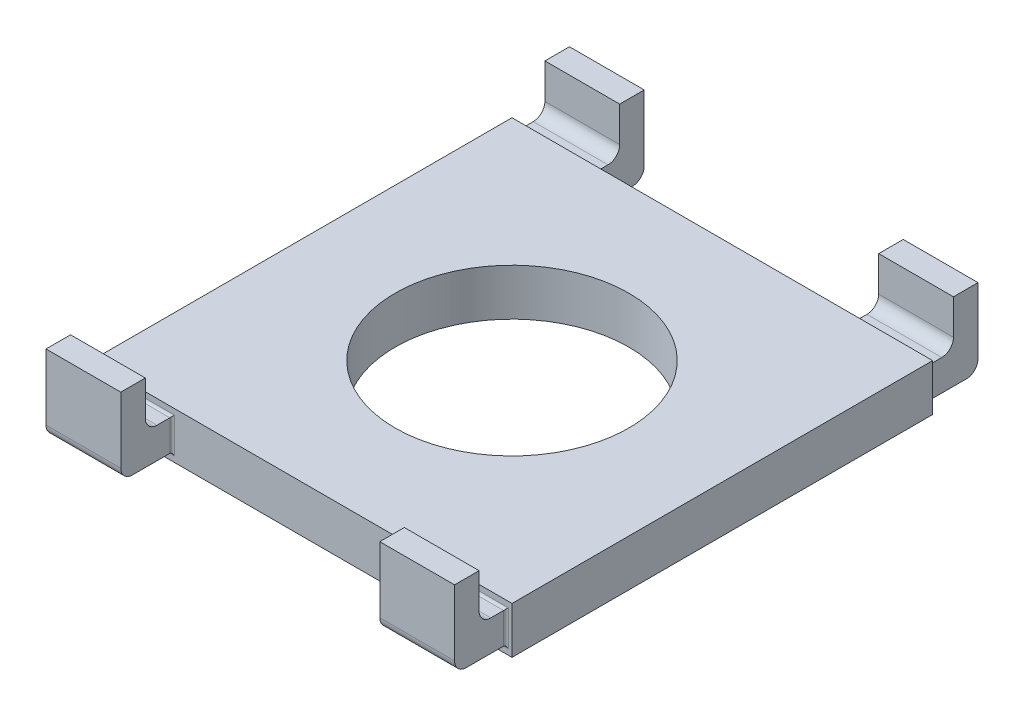
from build123d import *

# Parameters (mm, degrees)
SKETCH2_W           = 45
SKETCH2_H           = 45
BOSS_EXTRUDE1_DEPTH = 5
SKETCH3_W           = 8
SKETCH3_H           = 3.3
BOSS_EXTRUDE2_DEPTH = 28
FILLET1_R           = 0.25
SKETCH4_W           = 8
SKETCH4_H           = 2.625
BOSS_EXTRUDE3_DEPTH = 5
FILLET2_R           = 1.25
SKETCH6_R           = 12.5
CUT_EXTRUDE1_DEPTH  = 19


with BuildPart() as part:
    # Sketch2 → Boss-Extrude1 (new body)
    with BuildSketch(Plane(origin=(0, 0, 0), x_dir=(1, 0, 0), z_dir=(0, 1, 0))):
        Rectangle(SKETCH2_W, SKETCH2_H)
    extrude(amount=BOSS_EXTRUDE1_DEPTH)

    # Sketch3 → Boss-Extrude2 (add, symmetric)
    with BuildSketch(Plane.XY):
        with Locations((-17.853613933, 2.5)):
            Rectangle(SKETCH3_W, SKETCH3_H)
        with Locations((17.853613933, 2.5)):
            Rectangle(SKETCH3_W, SKETCH3_H)
    extrude(amount=BOSS_EXTRUDE2_DEPTH, both=True)

    # Fillet1
    fillet1_edges = [part.edges().sort_by_distance(p)[0] for p in [
        (21.853613933, 2.5, 22.5),
        (17.853613933, 0.85, 22.5),
        (13.853613933, 2.5, 22.5),
        (17.853613933, 4.15, 22.5),
        (-17.853613933, 0.85, 22.5),
        (-21.853613933, 2.5, 22.5),
        (-17.853613933, 4.15, 22.5),
        (-13.853613933, 2.5, 22.5),
        (-13.853613933, 2.5, -22.5),
        (-17.853613933, 4.15, -22.5),
        (-21.853613933, 2.5, -22.5),
        (-17.853613933, 0.85, -22.5),
        (17.853613933, 4.15, -22.5),
        (13.853613933, 2.5, -22.5),
        (17.853613933, 0.85, -22.5),
        (21.853613933, 2.5, -22.5),
    ]]
    fillet(fillet1_edges, radius=FILLET1_R)

    # Sketch4 → Boss-Extrude3 (add)
    with BuildSketch(Plane(origin=(0, 4.15, 0), x_dir=(1, 0, 0), z_dir=(0, 1, 0))):
        with Locations((-17.853613933, 26.6875)):
            Rectangle(SKETCH4_W, SKETCH4_H)
        with Locations((17.853613933, 26.6875)):
            Rectangle(SKETCH4_W, SKETCH4_H)
        with Locations((17.853613933, -26.6875)):
            Rectangle(SKETCH4_W, SKETCH4_H)
        with Locations((-17.853613933, -26.6875)):
            Rectangle(SKETCH4_W, SKETCH4_H)
    extrude(amount=BOSS_EXTRUDE3_DEPTH)

    # Fillet2
    fillet2_edges = [part.edges().sort_by_distance(p)[0] for p in [
        (-17.853613933, 4.15, 25.375),
        (17.853613933, 4.15, 25.375),
        (17.853613933, 4.15, -25.375),
        (-17.853613933, 4.15, -25.375),
        (-17.853613933, 0.85, -28),
        (-17.853613933, 0.85, 28),
        (17.853613933, 0.85, -28),
        (17.853613933, 0.85, 28),
    ]]
    fillet(fillet2_edges, radius=FILLET2_R)

    # Sketch6 → Cut-Extrude1 (cut)
    with BuildSketch(Plane(origin=(0, 5, 0), x_dir=(1, 0, 0), z_dir=(0, 1, 0))):
        with Locations(Location((0, 0, 0), (0, 0, 270))):
            Circle(SKETCH6_R)
    extrude(amount=-CUT_EXTRUDE1_DEPTH, mode=Mode.SUBTRACT)


solid = part.part
